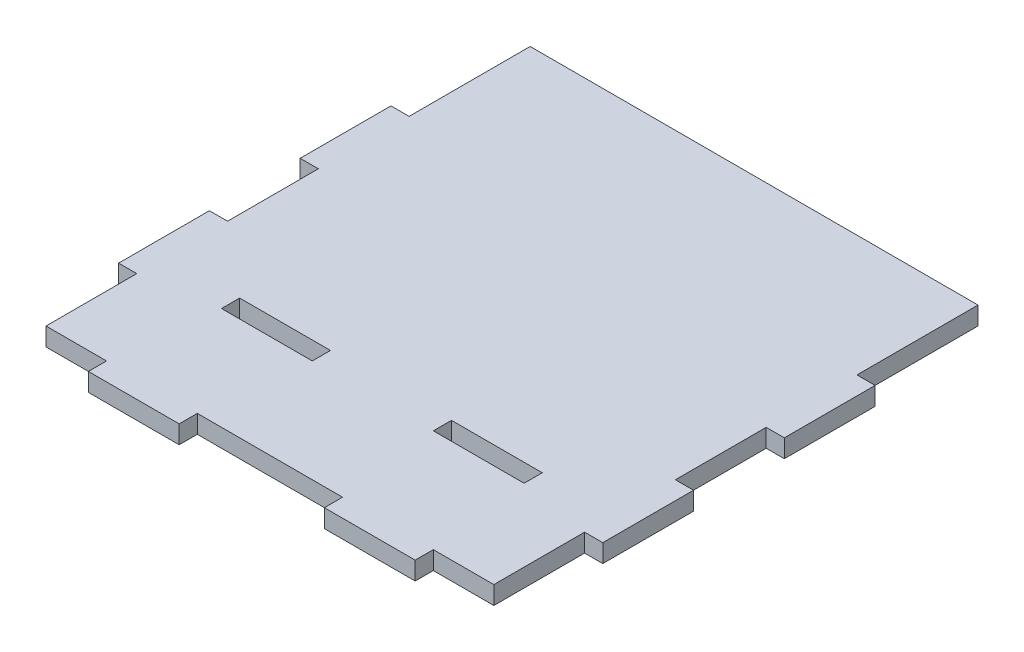
from build123d import *

# Parameters (mm, degrees)
SKETCH_1_W          = 74
SKETCH_1_H          = 80
SKETCH_1_W_2        = 3
SKETCH_1_H_2        = 15
SKETCH_1_W_3        = 15
SKETCH_1_H_3        = 3
EXTRUDE_1_DEPTH     = 3
SKETCH_2_W          = 15
SKETCH_2_H          = 3
CUT_EXTRUDE_1_DEPTH = 3


with BuildPart() as part:
    # 草图1 → 凸台-拉伸1 (new body)
    with BuildSketch(Plane(origin=(0, 0, 0), x_dir=(1, 0, 0), z_dir=(0, 1, 0))):
        Rectangle(SKETCH_1_W, SKETCH_1_H)
        with Locations((-38.5, -17.5)):
            Rectangle(SKETCH_1_W_2, SKETCH_1_H_2)
        with Locations((-19.5, -41.5)):
            Rectangle(SKETCH_1_W_3, SKETCH_1_H_3)
        with Locations((19.5, -41.5)):
            Rectangle(SKETCH_1_W_3, SKETCH_1_H_3)
        with Locations((38.5, -17.5)):
            Rectangle(SKETCH_1_W_2, SKETCH_1_H_2)
        with Locations((38.5, 12.5)):
            Rectangle(SKETCH_1_W_2, SKETCH_1_H_2)
        with Locations((-38.5, 12.5)):
            Rectangle(SKETCH_1_W_2, SKETCH_1_H_2)
    extrude(amount=EXTRUDE_1_DEPTH)

    # 草图2 → 切除-拉伸1 (cut)
    with BuildSketch(Plane(origin=(0, 3, 0), x_dir=(1, 0, 0), z_dir=(0, 1, 0))):
        with Locations((-17.5, -21.5)):
            Rectangle(SKETCH_2_W, SKETCH_2_H)
        with Locations((17.5, -21.5)):
            Rectangle(SKETCH_2_W, SKETCH_2_H)
    extrude(amount=-CUT_EXTRUDE_1_DEPTH, mode=Mode.SUBTRACT)


solid = part.part
